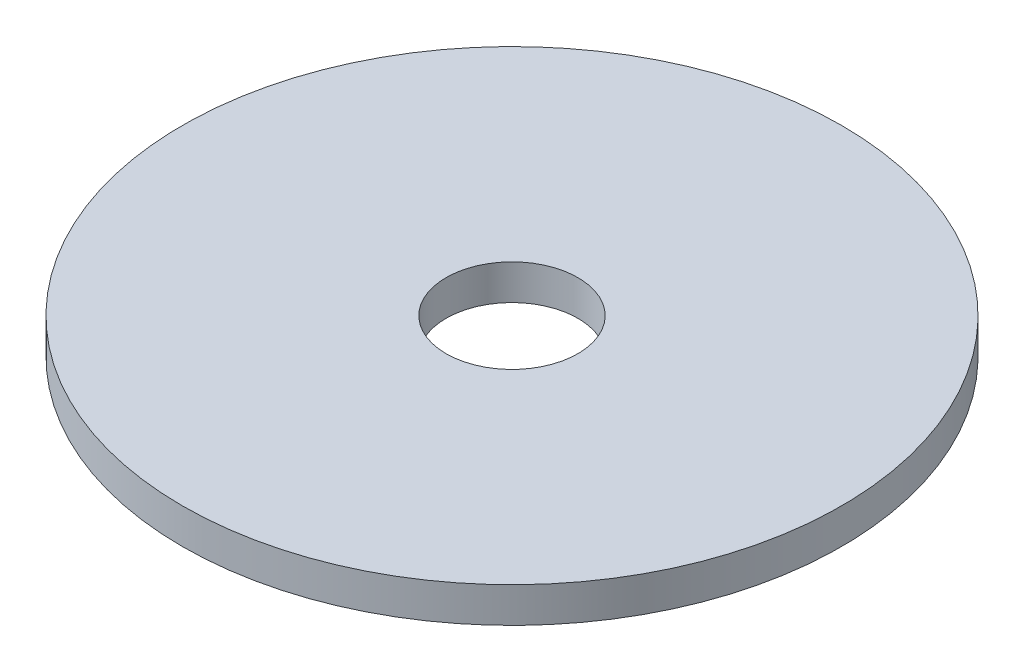
from build123d import *

# Parameters (mm, degrees)
SKETCH1_W = 24
SKETCH1_H = 3.210919522


with BuildPart() as part:
    # Sketch1 → Revolve1 (revolve)
    with BuildSketch(Plane(origin=(0, 0, 0), x_dir=(0, 0, -1), z_dir=(1, 0, 0))):
        with Locations((-18, 0)):
            Rectangle(SKETCH1_W, SKETCH1_H)
    revolve(axis=Axis((0, 21.860595279, 0), (0, -1, 0)))


solid = part.part
